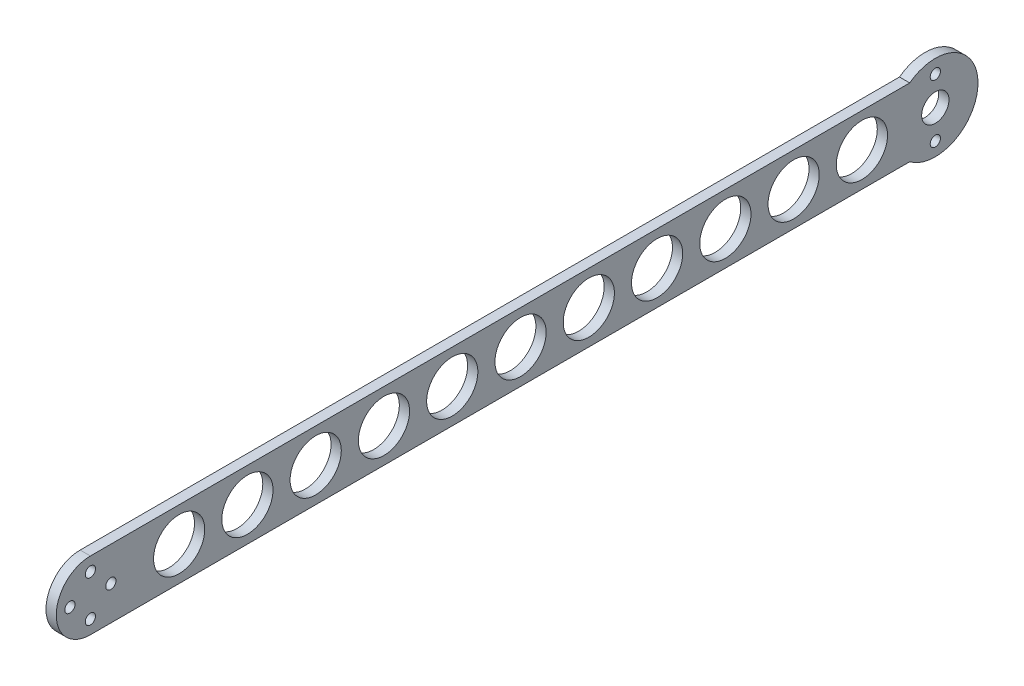
from build123d import *

# Parameters (mm, degrees)
EXTRUDE_1_DEPTH     = 3
SKETCH_2_R          = 1.5
SKETCH_2_R_2        = 4
CUT_EXTRUDE_1_DEPTH = 3
SKETCH_4_R          = 7.5
CUT_EXTRUDE_2_DEPTH = 250


with BuildPart() as part:
    # 草图1 → 凸台-拉伸1 (new body)
    with BuildSketch(Plane(origin=(0, 0, 0), x_dir=(0, 0, -1), z_dir=(1, 0, 0))):
        with BuildLine():
            Line((-120, 10), (120, 10))
            ThreePointArc((120, 10), (140, 0), (120, -10))
            Line((120, -10), (-120, -10))
            ThreePointArc((-120, -10), (-130.000001885, 0), (-120, 10))
        make_face()
    extrude(amount=EXTRUDE_1_DEPTH)

    # 草图2 → 切除-拉伸1 (cut)
    with BuildSketch(Plane(origin=(3, 0, 0), x_dir=(0, 0, -1), z_dir=(1, 0, 0))):
        with Locations((-120, 6)):
            Circle(SKETCH_2_R)
        with Locations((-114, 0)):
            Circle(SKETCH_2_R)
        with Locations((-120, -6)):
            Circle(SKETCH_2_R)
        with Locations((-126, 0)):
            Circle(SKETCH_2_R)
        with Locations((127.5, 8.5)):
            Circle(SKETCH_2_R)
        with Locations((127.5, -8.5)):
            Circle(SKETCH_2_R)
        with Locations((127.5, 0)):
            Circle(SKETCH_2_R_2)
    extrude(amount=-CUT_EXTRUDE_1_DEPTH, mode=Mode.SUBTRACT)

    # 草图4 → 切除-拉伸2 (cut)
    with BuildSketch(Plane(origin=(3, 0, 0), x_dir=(0, 0, -1), z_dir=(1, 0, 0))):
        with Locations((-94, 0)):
            Circle(SKETCH_4_R)
        with Locations((-74, 0)):
            Circle(SKETCH_4_R)
        with Locations((-54, 0)):
            Circle(SKETCH_4_R)
        with Locations((-34, 0)):
            Circle(SKETCH_4_R)
        with Locations((-14, 0)):
            Circle(SKETCH_4_R)
        with Locations((6, 0)):
            Circle(SKETCH_4_R)
        with Locations((26, 0)):
            Circle(SKETCH_4_R)
        with Locations((46, 0)):
            Circle(SKETCH_4_R)
        with Locations((66, 0)):
            Circle(SKETCH_4_R)
        with Locations((86, 0)):
            Circle(SKETCH_4_R)
        with Locations((106, 0)):
            Circle(SKETCH_4_R)
    extrude(amount=-CUT_EXTRUDE_2_DEPTH, mode=Mode.SUBTRACT)


solid = part.part
